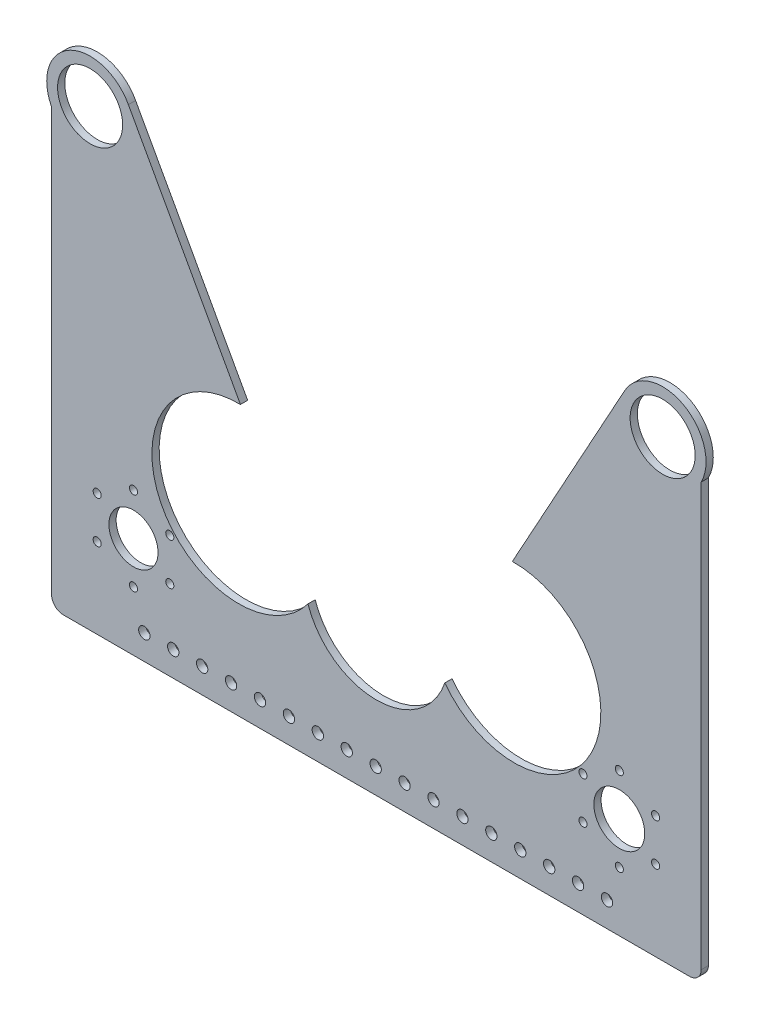
from build123d import *

# Parameters (mm, degrees)
SKETCH2_R           = 2.4892
SKETCH2_R_2         = 1.778
SKETCH2_R_3         = 10.795
SKETCH2_R_4         = 11.176
SKETCH2_R_5         = 14.2875
BOSS_EXTRUDE1_DEPTH = 3.175


with BuildPart() as part:
    # Sketch2 → Boss-Extrude1 (new body)
    with BuildSketch(Plane.XY):
        with BuildLine():
            Line((142.632381685, -29.937060043), (142.632381685, 122.462939957))
            ThreePointArc((142.632381685, 122.462939957), (134.600001748, 148.101160684), (108.918256202, 140.209048468))
            Line((108.918256202, 140.209048468), (59.7049135, 50.792022715))
            ThreePointArc((59.7049135, 50.792022715), (87.148239137, 39.915009432), (98.584532313, 12.7))
            ThreePointArc((98.584532313, 12.7), (72.574133919, -23.431032825), (30.056892785, -10.229647899))
            ThreePointArc((30.056892785, -10.229647899), (0, -31.75), (-30.056892785, -10.229647899))
            ThreePointArc((-30.056892785, -10.229647899), (-94.75382344, -3.950095664), (-59.7049135, 50.792022715))
            Line((-59.7049135, 50.792022715), (-108.918256202, 140.209048469))
            ThreePointArc((-108.918256202, 140.209048469), (-134.600001748, 148.101160684), (-142.632381685, 122.462939957))
            Line((-142.632381685, 122.462939957), (-142.632381685, -29.937060043))
            Line((-142.632381685, -29.937060043), (-142.632381685, -57.15))
            Line((-142.632381685, -57.15), (-142.632381685, -63.028571866))
            ThreePointArc((-142.632381685, -63.028571866), (-141.144484133, -66.620674314), (-137.552381685, -68.108571866))
            Line((-137.552381685, -68.108571866), (137.552381685, -68.108571866))
            ThreePointArc((137.552381685, -68.108571866), (141.144484133, -66.620674314), (142.632381685, -63.028571866))
            Line((142.632381685, -63.028571866), (142.632381685, -57.15))
            Line((142.632381685, -57.15), (142.632381685, -29.937060043))
        make_face()
        with Locations((-101.9175, -57.15)):
            Circle(SKETCH2_R, mode=Mode.SUBTRACT)
        with Locations((-89.2175, -57.15)):
            Circle(SKETCH2_R, mode=Mode.SUBTRACT)
        with Locations((-76.5175, -57.15)):
            Circle(SKETCH2_R, mode=Mode.SUBTRACT)
        with Locations((-106.68, -42.073571866)):
            Circle(SKETCH2_R_2, mode=Mode.SUBTRACT)
        with Locations((-122.627857811, -32.866071866)):
            Circle(SKETCH2_R_2, mode=Mode.SUBTRACT)
        with Locations((-122.627857811, -14.451071866)):
            Circle(SKETCH2_R_2, mode=Mode.SUBTRACT)
        with Locations((-90.732142189, -32.866071866)):
            Circle(SKETCH2_R_2, mode=Mode.SUBTRACT)
        with Locations((-106.68, -23.658571866)):
            Circle(SKETCH2_R_3, mode=Mode.SUBTRACT)
        with Locations((-90.732142189, -14.451071866)):
            Circle(SKETCH2_R_2, mode=Mode.SUBTRACT)
        with Locations((-63.8175, -57.15)):
            Circle(SKETCH2_R, mode=Mode.SUBTRACT)
        with Locations((-51.1175, -57.15)):
            Circle(SKETCH2_R, mode=Mode.SUBTRACT)
        with Locations((-38.4175, -57.15)):
            Circle(SKETCH2_R, mode=Mode.SUBTRACT)
        with Locations((-25.7175, -57.15)):
            Circle(SKETCH2_R, mode=Mode.SUBTRACT)
        with Locations((-13.0175, -57.15)):
            Circle(SKETCH2_R, mode=Mode.SUBTRACT)
        with Locations((-0.3175, -57.15)):
            Circle(SKETCH2_R, mode=Mode.SUBTRACT)
        with Locations((-106.68, -5.243571866)):
            Circle(SKETCH2_R_2, mode=Mode.SUBTRACT)
        with Locations((12.3825, -57.15)):
            Circle(SKETCH2_R, mode=Mode.SUBTRACT)
        with Locations((25.0825, -57.15)):
            Circle(SKETCH2_R, mode=Mode.SUBTRACT)
        with Locations((37.7825, -57.15)):
            Circle(SKETCH2_R, mode=Mode.SUBTRACT)
        with Locations((50.4825, -57.15)):
            Circle(SKETCH2_R, mode=Mode.SUBTRACT)
        with Locations((63.1825, -57.15)):
            Circle(SKETCH2_R, mode=Mode.SUBTRACT)
        with Locations((75.8825, -57.15)):
            Circle(SKETCH2_R, mode=Mode.SUBTRACT)
        with Locations((88.5825, -57.15)):
            Circle(SKETCH2_R, mode=Mode.SUBTRACT)
        with Locations((101.2825, -57.15)):
            Circle(SKETCH2_R, mode=Mode.SUBTRACT)
        with Locations((106.68, -42.073571866)):
            Circle(SKETCH2_R_2, mode=Mode.SUBTRACT)
        with Locations((90.732142189, -32.866071866)):
            Circle(SKETCH2_R_2, mode=Mode.SUBTRACT)
        with Locations((106.68, -23.658571866)):
            Circle(SKETCH2_R_4, mode=Mode.SUBTRACT)
        with Locations((90.732142189, -14.451071866)):
            Circle(SKETCH2_R_2, mode=Mode.SUBTRACT)
        with Locations((122.627857811, -32.866071866)):
            Circle(SKETCH2_R_2, mode=Mode.SUBTRACT)
        with Locations((122.627857811, -14.451071866)):
            Circle(SKETCH2_R_2, mode=Mode.SUBTRACT)
        with Locations((106.68, -5.243571866)):
            Circle(SKETCH2_R_2, mode=Mode.SUBTRACT)
        with Locations((-125.726814921, 131.243846084)):
            Circle(SKETCH2_R_5, mode=Mode.SUBTRACT)
        with Locations((125.726814921, 131.243846084)):
            Circle(SKETCH2_R_5, mode=Mode.SUBTRACT)
    extrude(amount=BOSS_EXTRUDE1_DEPTH)


solid = part.part
